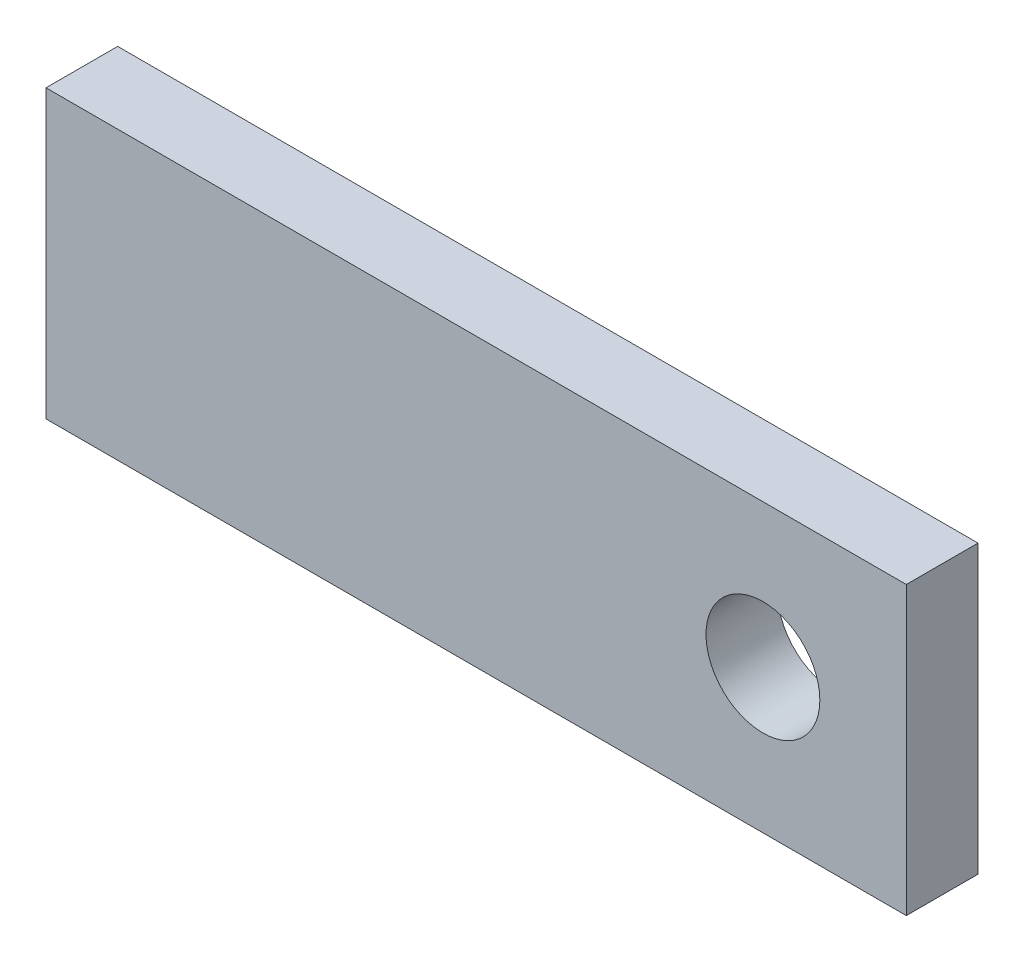
from build123d import *

# Parameters (mm, degrees)
SKETCH1_W                   = 76.2
SKETCH1_H                   = 25.4
EXTRUDE1_DEPTH              = 6.35
F_3_8_CLEARANCE_HOLE1_D     = 10.0838
F_3_8_CLEARANCE_HOLE1_DEPTH = 16.002
F_3_8_CLEARANCE_HOLE1_TIP   = 3.029479155


with BuildPart() as part:
    # Sketch1 → Extrude1 (new body)
    with BuildSketch(Plane.XY):
        Rectangle(SKETCH1_W, SKETCH1_H)
    extrude(amount=EXTRUDE1_DEPTH)

    # 3/8 Clearance Hole1
    with Locations(Plane(origin=(25.4, 0, 6.35), x_dir=(1, 0, 0), z_dir=(0, 0, 1))):
        with Locations((0, 0)):
            Hole(F_3_8_CLEARANCE_HOLE1_D / 2, depth=F_3_8_CLEARANCE_HOLE1_DEPTH)
            with Locations((0, 0, -(F_3_8_CLEARANCE_HOLE1_DEPTH + F_3_8_CLEARANCE_HOLE1_TIP / 2))):  # 118° drill point
                Cone(0, F_3_8_CLEARANCE_HOLE1_D / 2, F_3_8_CLEARANCE_HOLE1_TIP, mode=Mode.SUBTRACT)


solid = part.part
